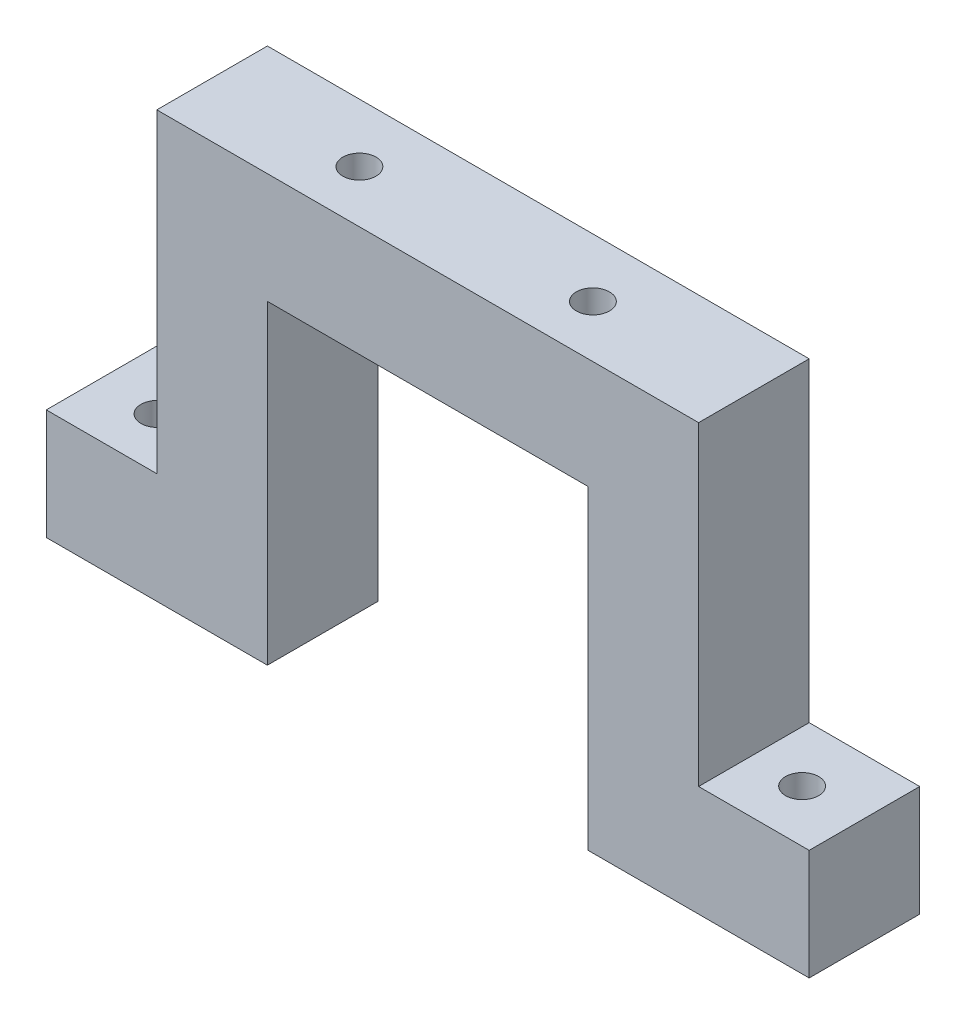
from build123d import *

# Parameters (mm, degrees)
EXTRUDE_THIN1_DEPTH     = 10
CUT_EXTRUDE1_DEPTH      = 38
CUT_EXTRUDE1_DEPTH_BACK = 45
SKETCH2_R               = 1.5


with BuildPart() as part:
    # Sketch1 → Extrude-Thin1 (new body)
    with BuildSketch(Plane.XY):
        Polygon((0, 0), (10, 0), (10, 28.5), (59, 28.5), (59, 0), (69, 0), (69, -10), (49, -10), (49, 18.5), (20, 18.5), (20, -10), (0, -10), align=None)
    extrude(amount=EXTRUDE_THIN1_DEPTH)

    # Sketch2 → Cut-Extrude1 (cut, two sides: drawn at the far end of the back side and taken through both)
    with BuildSketch(Plane(origin=(0, 0, 0), x_dir=(1, 0, 0), z_dir=(0, 1, 0)).offset(-CUT_EXTRUDE1_DEPTH_BACK)):
        with Locations(Location((5.34788965, -5.287124533, 0), (0, 0, 270))):
            Circle(SKETCH2_R)
        with Locations(Location((63.65, -5.287124533, 0), (0, 0, 180))):
            Circle(SKETCH2_R)
        with Locations(Location((23.609987296, -5.287124533, 0), (0, 0, 270))):
            Circle(SKETCH2_R)
        with Locations(Location((44.725702821, -5.287124533, 0), (0, 0, 270))):
            Circle(SKETCH2_R)
    extrude(amount=CUT_EXTRUDE1_DEPTH + CUT_EXTRUDE1_DEPTH_BACK, mode=Mode.SUBTRACT)


solid = part.part
